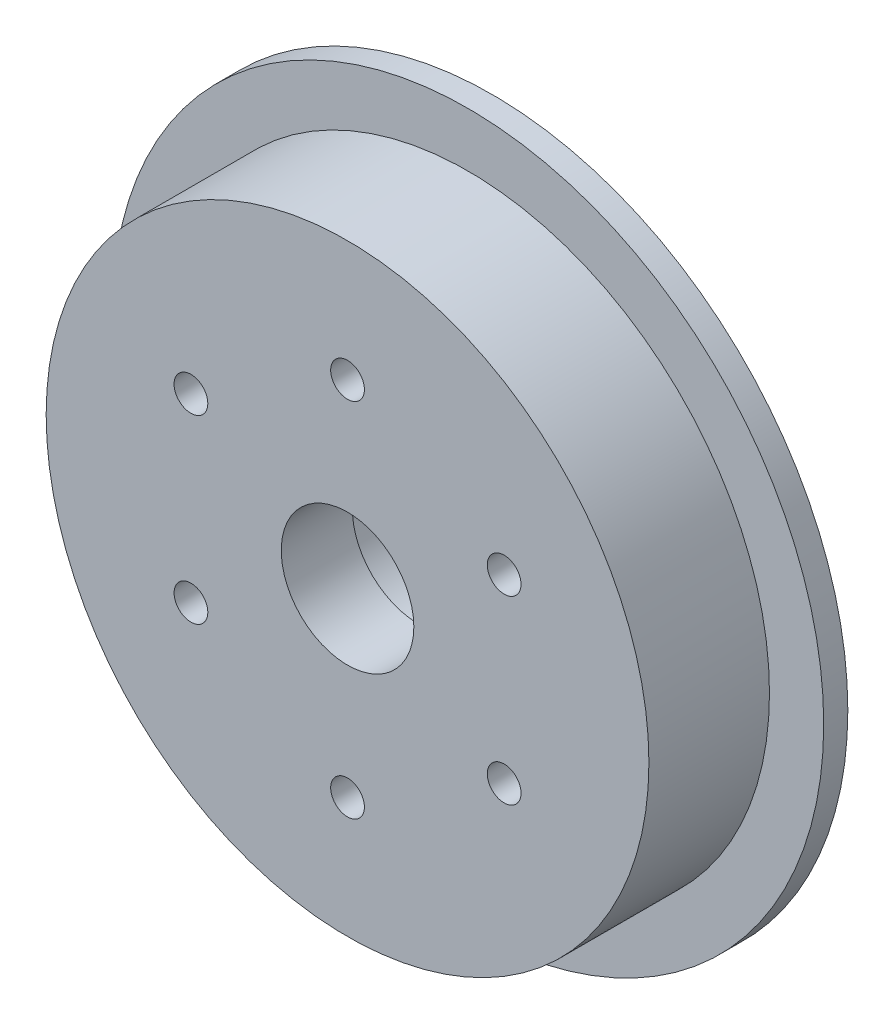
from build123d import *

# Parameters (mm, degrees)
SKETCH_2_R          = 29.5
EXTRUDE_1_DEPTH     = 2
SKETCH_3_R          = 25
EXTRUDE_2_DEPTH     = 10
SKETCH_7_R          = 1.4
CUT_EXTRUDE_3_DEPTH = 12
CUT_EXTRUDE_4_REACH = 45.411
SKETCH_9_R          = 6.5
EXTRUDE_START       = -5.9
SKETCH_10_R         = 6.5
SKETCH_10_R_2       = 5.5
EXTRUDE_4_DEPTH     = 5.9


with BuildPart() as part:
    # 草图2 → 凸台-拉伸1 (new body)
    with BuildSketch(Plane.XY):
        Circle(SKETCH_2_R)
    extrude(amount=EXTRUDE_1_DEPTH)

    # 草图3 → 凸台-拉伸2 (add)
    with BuildSketch(Plane.XY.offset(2)):
        Circle(SKETCH_3_R)
    extrude(amount=EXTRUDE_2_DEPTH)

    # 草图7 → 切除-拉伸3 (cut)
    with BuildSketch(Plane.XY.offset(12)):
        with Locations((12.990381057, 7.5)):
            Circle(SKETCH_7_R)
        with Locations((12.990381057, -7.5)):
            Circle(SKETCH_7_R)
        with Locations((0, -15)):
            Circle(SKETCH_7_R)
        with Locations((-12.990381057, -7.5)):
            Circle(SKETCH_7_R)
        with Locations((-12.990381057, 7.5)):
            Circle(SKETCH_7_R)
        with Locations((0, 15)):
            Circle(SKETCH_7_R)
    extrude(amount=-CUT_EXTRUDE_3_DEPTH, mode=Mode.SUBTRACT)

    # 草图9 → 切除-拉伸4 (cut, up to next)
    with BuildSketch(Plane(origin=(0, 0, 0), x_dir=(-1, 0, 0), z_dir=(0, 0, -1)), mode=Mode.PRIVATE) as cut_extrude_4_sk1:
        Circle(SKETCH_9_R)
    cut_extrude_4_tool1 = extrude(cut_extrude_4_sk1.sketch, amount=-CUT_EXTRUDE_4_REACH, mode=Mode.PRIVATE) & part.part
    add(cut_extrude_4_tool1.solids().sort_by_distance((0, 0, 0))[0], mode=Mode.SUBTRACT)

    # 草图10 → 凸台-拉伸4 (add)
    with BuildSketch(Plane.XY.offset(12).offset(EXTRUDE_START)):
        with Locations(Location((0, 0, 0), (0, 0, 180))):
            Circle(SKETCH_10_R)
        Circle(SKETCH_10_R_2, mode=Mode.SUBTRACT)
    extrude(amount=EXTRUDE_4_DEPTH)


solid = part.part
